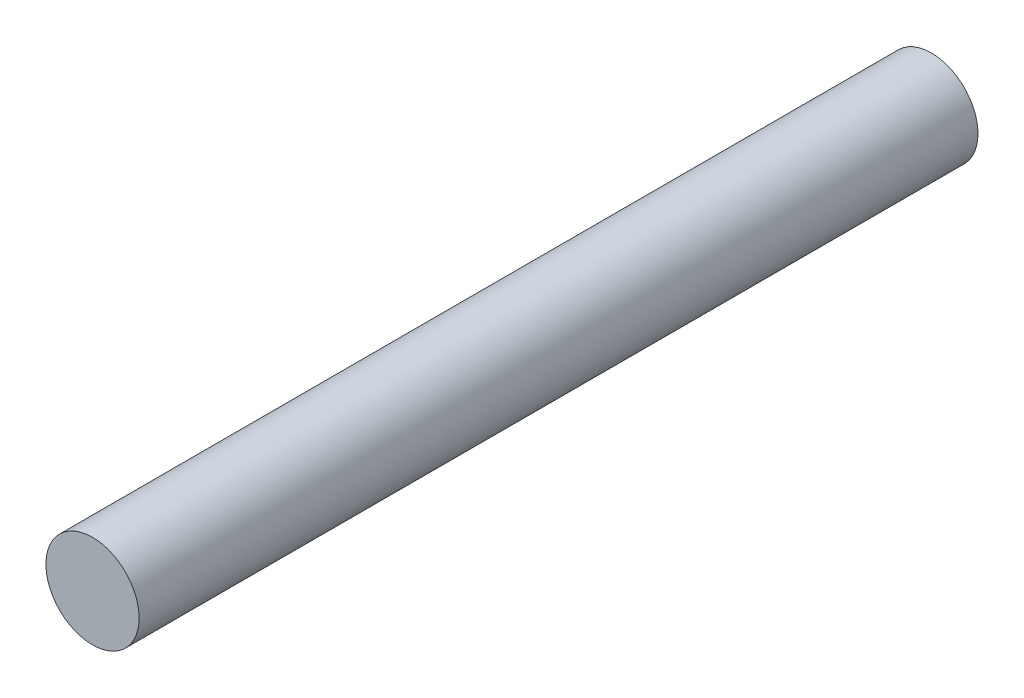
from build123d import *

# Parameters (mm, degrees)
ESBO_O1_R                = 5
RESSALTO_EXTRUS_O1_DEPTH = 90


with BuildPart() as part:
    # Esboço1 → Ressalto-extrusão1 (new body)
    with BuildSketch(Plane.XY):
        Circle(ESBO_O1_R)
    extrude(amount=-RESSALTO_EXTRUS_O1_DEPTH)


solid = part.part
